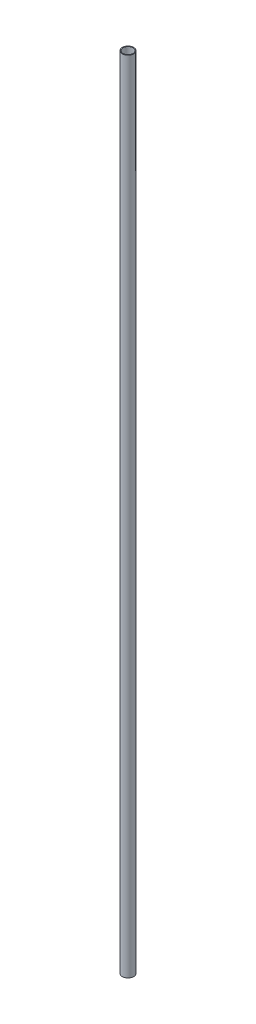
from build123d import *

# Parameters (mm, degrees)
SCHIZZO1_R                   = 8
SCHIZZO1_R_2                 = 7
ESTRUSIONE_ESTRUSIONE1_DEPTH = 1130


with BuildPart() as part:
    # Schizzo1 → Estrusione-Estrusione1 (new body)
    with BuildSketch(Plane(origin=(0, 0, 0), x_dir=(1, 0, 0), z_dir=(0, 1, 0))):
        with Locations(Location((0, 0, 0), (0, 0, 270))):
            Circle(SCHIZZO1_R)
        with Locations(Location((0, 0, 0), (0, 0, 270))):
            Circle(SCHIZZO1_R_2, mode=Mode.SUBTRACT)
    extrude(amount=ESTRUSIONE_ESTRUSIONE1_DEPTH)


solid = part.part
